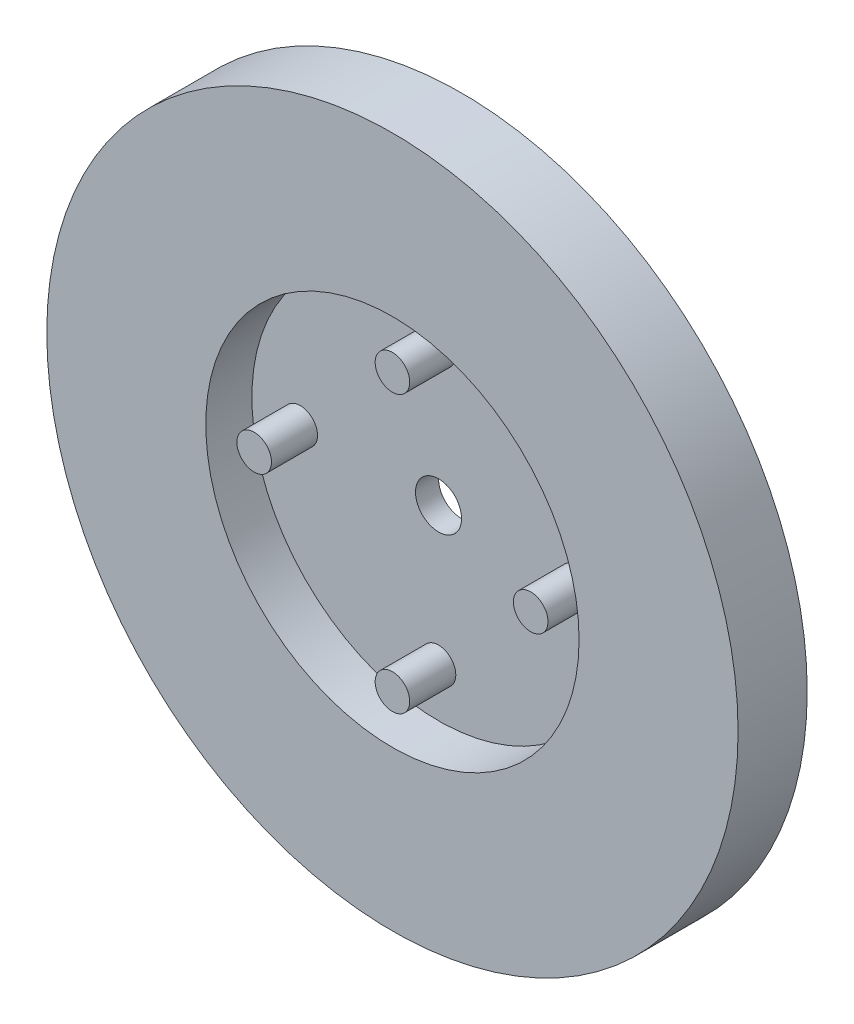
from build123d import *

# Parameters (mm, degrees)
SKETCH1_R           = 8.1
SKETCH1_R_2         = 1
BOSS_EXTRUDE1_DEPTH = 1
SKETCH1_3_R         = 15
SKETCH1_3_R_2       = 8.1
SKETCH1_3_R_3       = 0.75
BOSS_EXTRUDE2_DEPTH = 3


with BuildPart() as part:
    # Sketch1 → Boss-Extrude1 (new body)
    with BuildSketch(Plane.XY):
        Circle(SKETCH1_R)
        Circle(SKETCH1_R_2, mode=Mode.SUBTRACT)
    extrude(amount=BOSS_EXTRUDE1_DEPTH)

    # Sketch1<3> → Boss-Extrude2 (add)
    # profile 1 of 5: a face of its own
    with BuildSketch(Plane.XY):
        Circle(SKETCH1_3_R)
        Circle(SKETCH1_3_R_2, mode=Mode.SUBTRACT)
    # profile 2 of 5: a face of its own
    with BuildSketch(Plane.XY):
        with Locations((-6, 0)):
            Circle(SKETCH1_3_R_3)
    # profile 3 of 5: a face of its own
    with BuildSketch(Plane.XY):
        with Locations((0, -6)):
            Circle(SKETCH1_3_R_3)
    # profile 4 of 5: a face of its own
    with BuildSketch(Plane.XY):
        with Locations((6, 0)):
            Circle(SKETCH1_3_R_3)
    # profile 5 of 5: a face of its own
    with BuildSketch(Plane.XY):
        with Locations((0, 6)):
            Circle(SKETCH1_3_R_3)
    extrude(amount=BOSS_EXTRUDE2_DEPTH)


solid = part.part
